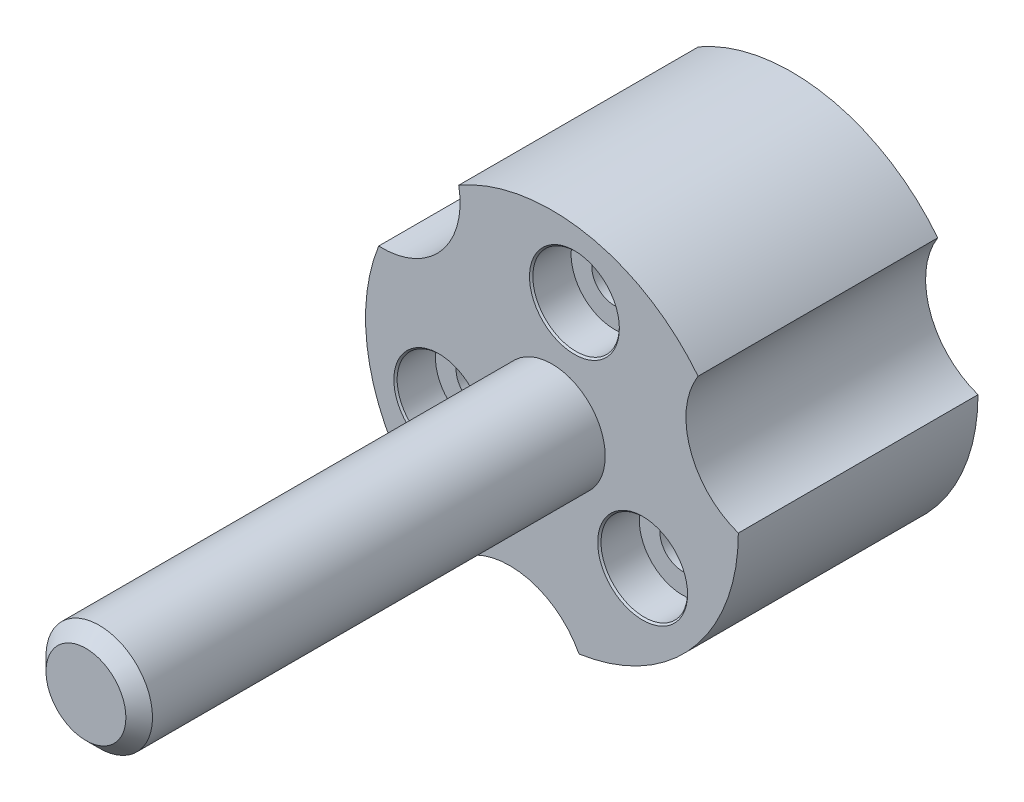
from build123d import *

# Parameters (mm, degrees)
RESSALTO_EXTRUS_O1_DEPTH = 18
ESBO_O2_R                = 4
RESSALTO_EXTRUS_O2_DEPTH = 35
CHANFRO1_SIZE            = 1
PADR_OCIRCULAR1_COUNT    = 3
ESBO_O6_R                = 6
CORTE_EXTRUS_O1_DEPTH    = 3
ESBO_O6_4_R              = 4
CORTE_EXTRUS_O2_DEPTH    = 14


with BuildPart() as part:
    # Esboço1 → Ressalto-extrusão1 (new body)
    with BuildSketch(Plane.XY):
        with BuildLine():
            ThreePointArc((10.389270368, 3.614285714), (10.102290249, 6.219039436), (10.977142857, 8.689207944))
            ThreePointArc((10.977142857, 8.689207944), (2.627637013, 13.75120081), (-7, 12.124355653))
            ThreePointArc((-7, 12.124355653), (-8.324698429, 7.190229208), (-13.013646247, 5.161880603))
            ThreePointArc((-13.013646247, 5.161880603), (-13.222707741, -4.6), (-7, -12.124355653))
            ThreePointArc((-7, -12.124355653), (-2.064571939, -10.804514922), (2.03650339, -13.851088547))
            ThreePointArc((2.03650339, -13.851088547), (10.595070728, -9.15120081), (14, 0))
            ThreePointArc((14, 0), (11.780915009, 1.39382974), (10.389270368, 3.614285714))
        make_face()
    extrude(amount=RESSALTO_EXTRUS_O1_DEPTH)

    # Esboço2 → Ressalto-extrusão2 (add)
    with BuildSketch(Plane.XY.offset(18)):
        Circle(ESBO_O2_R)
    extrude(amount=RESSALTO_EXTRUS_O2_DEPTH)

    # Chanfro1
    chanfro1_edges = [part.edges().sort_by_distance(p)[0] for p in [
        (-4, 0, 53),
    ]]
    chamfer(chanfro1_edges, length=CHANFRO1_SIZE)

    # Esboço5 → Rebaixo para SHCS M31 (revolve, cut)
    with BuildSketch(Plane(origin=(6.811116896, -5.882914807, 18), x_dir=(0, -1, 0), z_dir=(1, 0, 0))):
        Polygon((0, 0), (0, 18), (1.7, 18), (1.7, 3), (3.25, 3), (3.25, 0.125), (3.375, 0), align=None)
    rebaixo_para_shcs_m31 = revolve(axis=Axis((6.811116896, -5.882914807, 24.35), (0, 0, -1)), mode=Mode.SUBTRACT)

    # PadrãoCircular1: Rebaixo para SHCS M31 ×3 about axis
    padr_ocircular1_axis = Axis((0, 0, 18), (0, 0, 1))
    for i in range(1, PADR_OCIRCULAR1_COUNT):
        add(rebaixo_para_shcs_m31.rotate(padr_ocircular1_axis, i * 360 / PADR_OCIRCULAR1_COUNT), mode=Mode.SUBTRACT)

    # Esboço6 → Corte-extrusão1 (cut)
    with BuildSketch(Plane(origin=(0, 0, 0), x_dir=(-1, 0, 0), z_dir=(0, 0, -1))):
        Circle(ESBO_O6_R)
    extrude(amount=-CORTE_EXTRUS_O1_DEPTH, mode=Mode.SUBTRACT)

    # Esboço6<4> → Corte-extrusão2 (cut)
    with BuildSketch(Plane(origin=(0, 0, 0), x_dir=(-1, 0, 0), z_dir=(0, 0, -1))):
        Circle(ESBO_O6_4_R)
    extrude(amount=-CORTE_EXTRUS_O2_DEPTH, mode=Mode.SUBTRACT)


solid = part.part
